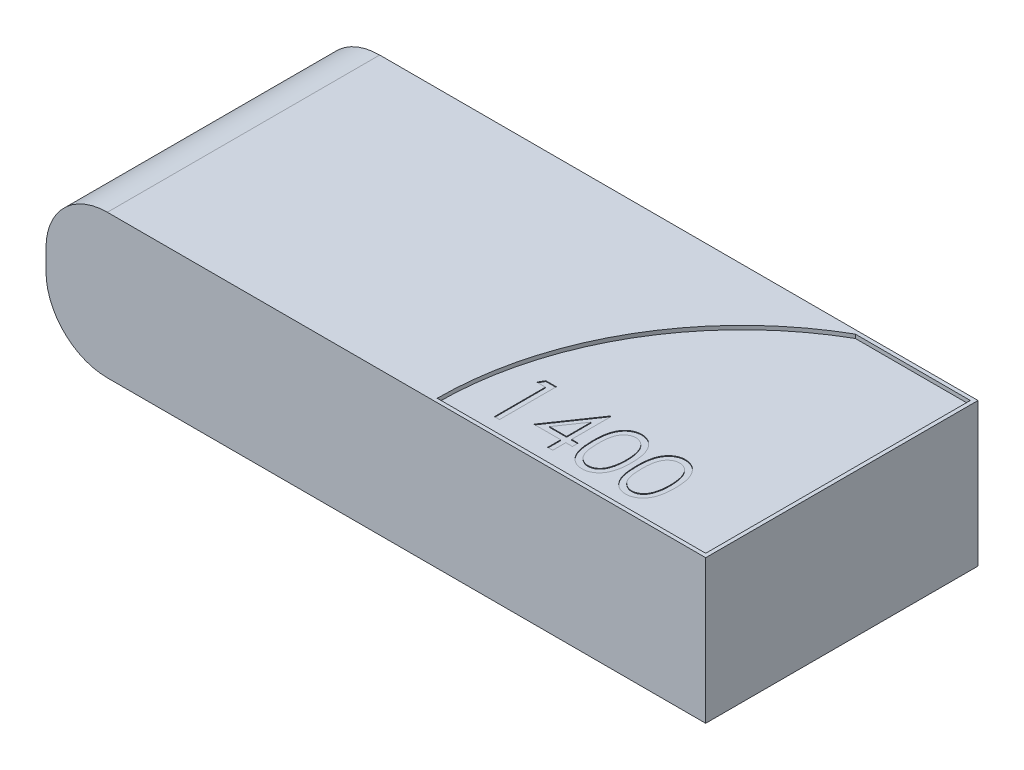
from build123d import *

# Parameters (mm, degrees)
CROQUIS1_W              = 86
CROQUIS1_H              = 35.5
SALIENTE_EXTRUIR1_DEPTH = 18.7
REDONDEO2_R             = 8
CORTAR_EXTRUIR1_DEPTH   = 0.5
CORTAR_EXTRUIR2_DEPTH   = 0.1


with BuildPart() as part:
    # Croquis1 → Saliente-Extruir1 (new body)
    with BuildSketch(Plane(origin=(0, 0, 0), x_dir=(1, 0, 0), z_dir=(0, 1, 0))):
        Rectangle(CROQUIS1_W, CROQUIS1_H)
    extrude(amount=SALIENTE_EXTRUIR1_DEPTH)

    # Redondeo2
    redondeo2_edges = [part.edges().sort_by_distance(p)[0] for p in [
        (-43, 18.7, 0),
        (-43, 0, 0),
    ]]
    fillet(redondeo2_edges, radius=REDONDEO2_R)

    # Croquis2 → Cortar-Extruir1 (cut)
    with BuildSketch(Plane(origin=(0, 18.7, 0), x_dir=(1, 0, 0), z_dir=(0, 1, 0))):
        with BuildLine():
            Line((27.5, 17.25), (42.5, 17.25))
            Line((42.5, 17.25), (42.5, -17.25))
            Line((42.5, -17.25), (7.5, -17.25))
            ThreePointArc((7.5, -17.25), (12.861527817, 2.688969382), (27.5, 17.25))
        make_face()
    extrude(amount=-CORTAR_EXTRUIR1_DEPTH, mode=Mode.SUBTRACT)

    # Croquis3 → Cortar-Extruir2 (cut)
    # profile 1 of 4: a face of its own
    with BuildSketch(Plane(origin=(0, 18.2, 0), x_dir=(1, 0, 0), z_dir=(0, 1, 0))):
        Polygon((12.095809708, -7.683191446), (13.465579673, -7.683191446), (13.465579673, -15.09152478), (12.800729246, -15.09152478), (12.800729246, -8.443020506), (11.660985656, -8.443020506), align=None)
    # profile 2 of 4: a face of its own
    with BuildSketch(Plane(origin=(0, 18.2, 0), x_dir=(1, 0, 0), z_dir=(0, 1, 0))):
        Polygon((20.263972101, -7.493234181), (20.399019844, -7.493234181), (20.399019844, -12.622080335), (21.253827537, -12.622080335), (21.253827537, -13.381909395), (20.399019844, -13.381909395), (20.399019844, -15.09152478), (19.734169417, -15.09152478), (19.734169417, -13.381909395), (16.219960015, -13.381909395), align=None)
        Polygon((19.734169417, -12.622080335), (19.734169417, -9.40467916), (17.525916212, -12.622080335), align=None, mode=Mode.SUBTRACT)
    # profile 3 of 4: a face of its own
    with BuildSketch(Plane(origin=(0, 18.2, 0), x_dir=(1, 0, 0), z_dir=(0, 1, 0))):
        with BuildLine():
            add(Edge.make_bspline(
                [(21.918677964, -11.390326195), (21.918313125, -11.159705758), (21.926227057, -10.823231018), (21.960672267, -10.389539715), (21.994801145, -10.09502077), (22.036375107, -9.821204903), (22.091862886, -9.568824699), (22.154967053, -9.336711858), (22.228102967, -9.124109523), (22.310627144, -8.928153385), (22.400446323, -8.745220042), (22.501125139, -8.575586286), (22.606909605, -8.416544629), (22.722081823, -8.270698476), (22.843364263, -8.135988168), (22.975490567, -8.015527101), (23.113969268, -7.905785681), (23.260054117, -7.809584594), (23.409581096, -7.724847557), (23.563579396, -7.652461757), (23.722469512, -7.595529094), (23.884823151, -7.54857043), (24.108615463, -7.505053349), (24.28033481, -7.492484949), (24.395542614, -7.493234181)],
                knots=[0, 0, 0, 0, 0.133246042, 0.194312586, 0.251279223, 0.304513439, 0.354234907, 0.400480589, 0.443410755, 0.484014869, 0.523252301, 0.561042373, 0.597900239, 0.633518489, 0.668314351, 0.702495671, 0.736685354, 0.770293169, 0.803437255, 0.835912952, 0.868460246, 0.900846538, 0.933466525, 1, 1, 1, 1], degree=3))
            add(Edge.make_bspline(
                [(24.395542614, -7.493234181), (24.512666822, -7.492895687), (24.686970466, -7.504648532), (24.914087617, -7.548841179), (25.078590081, -7.595192223), (25.239721551, -7.652769332), (25.396220213, -7.724916905), (25.549058554, -7.808904798), (25.695807658, -7.907591744), (25.838078595, -8.017620966), (25.972376783, -8.142001929), (26.098714448, -8.27947884), (26.218677178, -8.428580784), (26.328861525, -8.592167547), (26.433791957, -8.767393913), (26.527712764, -8.957324243), (26.618167837, -9.158789568), (26.696245251, -9.377364308), (26.766658971, -9.611816403), (26.823552104, -9.864915021), (26.870945517, -10.135332722), (26.907647533, -10.424060612), (26.944344957, -10.843884384), (26.950545458, -11.168663373), (26.952545485, -11.390326195)],
                knots=[0, 0, 0, 0, 0.067193932, 0.099862411, 0.132566612, 0.165151173, 0.197913187, 0.231319004, 0.265083278, 0.299255309, 0.334398567, 0.369942824, 0.406283561, 0.44406382, 0.482997707, 0.523354447, 0.56553659, 0.609612924, 0.656390811, 0.705885495, 0.7583245, 0.813831783, 0.872794559, 1, 1, 1, 1], degree=3))
            add(Edge.make_bspline(
                [(26.952545485, -11.390326195), (26.950329383, -11.610974536), (26.944749889, -11.934345357), (26.907118482, -12.352018265), (26.872815429, -12.639482078), (26.825292237, -12.908421114), (26.76686179, -13.159763429), (26.701985153, -13.394595072), (26.621901535, -13.610992084), (26.534248858, -13.811973232), (26.438882028, -13.999652029), (26.336710895, -14.175687349), (26.225398052, -14.338670147), (26.106751661, -14.489754969), (25.978232341, -14.626274945), (25.843462935, -14.751519504), (25.700773325, -14.862965558), (25.551735531, -14.960511332), (25.399422188, -15.047748761), (25.241130562, -15.118086017), (25.080448628, -15.178504646), (24.915075115, -15.224576231), (24.687311363, -15.267730543), (24.512898282, -15.2833612), (24.395542614, -15.281482044)],
                knots=[0, 0, 0, 0, 0.126773166, 0.185515763, 0.240764679, 0.292979796, 0.342250373, 0.388919286, 0.432775664, 0.474628433, 0.514774691, 0.553605893, 0.591426406, 0.62802812, 0.663803634, 0.698984336, 0.733591489, 0.767628469, 0.801208348, 0.83426384, 0.866980695, 0.899719742, 0.932701912, 1, 1, 1, 1], degree=3))
            add(Edge.make_bspline(
                [(24.395542614, -15.281482044), (24.280359086, -15.282136435), (24.108568403, -15.26984673), (23.885491342, -15.225994642), (23.723992842, -15.180714781), (23.56586391, -15.125212787), (23.413260141, -15.052924599), (23.264484534, -14.969666461), (23.119934076, -14.874849766), (22.982325001, -14.766218793), (22.850882954, -14.646067736), (22.728909997, -14.511398177), (22.615384494, -14.364336574), (22.507489341, -14.206235878), (22.408240166, -14.034937488), (22.316438531, -13.851120629), (22.23252645, -13.653597718), (22.158128551, -13.439486455), (22.092410464, -13.206337356), (22.040523979, -12.952092614), (21.99610259, -12.678794098), (21.960310019, -12.385267978), (21.926531926, -11.953938062), (21.918188685, -11.619475384), (21.918677964, -11.390326195)],
                knots=[0, 0, 0, 0, 0.066621658, 0.099284878, 0.131361165, 0.163585188, 0.196103927, 0.228902254, 0.262158056, 0.295991222, 0.330217846, 0.365059826, 0.400950737, 0.437620382, 0.475707529, 0.515380692, 0.556413541, 0.59976483, 0.646424156, 0.696431445, 0.749781518, 0.806573307, 0.867435532, 1, 1, 1, 1], degree=3))
        make_face()
        with BuildLine():
            add(Edge.make_bspline(
                [(22.583528391, -11.387358113), (22.58175995, -11.579410299), (22.590285803, -11.85870666), (22.614583447, -12.217710128), (22.63707085, -12.459546892), (22.670529213, -12.682114392), (22.708006483, -12.886943561), (22.7536171, -13.072950378), (22.807581438, -13.241411245), (22.869047555, -13.395185104), (22.936158293, -13.538274351), (23.008253492, -13.672369254), (23.088939025, -13.796265497), (23.176812581, -13.910366496), (23.269889295, -14.016694039), (23.371642994, -14.11150928), (23.512408951, -14.225255502), (23.698246977, -14.342594759), (24.007198977, -14.478529613), (24.25439921, -14.52169518), (24.417803231, -14.521652985)],
                knots=[0, 0, 0, 0, 0.141583694, 0.20592646, 0.265301357, 0.320597233, 0.371816503, 0.41878977, 0.461698729, 0.502133582, 0.540804315, 0.578180525, 0.614296865, 0.649678243, 0.68429946, 0.718358953, 0.752080865, 0.817652439, 0.879722076, 1, 1, 1, 1], degree=3))
            add(Edge.make_bspline(
                [(24.417803231, -14.521652985), (24.582085929, -14.524335037), (24.827635555, -14.479158561), (25.135678733, -14.347789878), (25.317872242, -14.231680096), (25.456475735, -14.120891284), (25.555784019, -14.026462674), (25.646930279, -13.920720672), (25.733385854, -13.806636303), (25.812648944, -13.682014815), (25.910940828, -13.498897795), (25.971116925, -13.351378999), (26.007211284, -13.249829734)],
                knots=[0, 0, 0, 0, 0.225393884, 0.339594815, 0.45967541, 0.52173519, 0.583925839, 0.648174145, 0.713881038, 0.781004455, 0.851450928, 1, 1, 1, 1], degree=3))
            add(Edge.make_bspline(
                [(26.007211284, -13.249829734), (26.053512838, -13.116052813), (26.119039252, -12.909639955), (26.179348223, -12.622852358), (26.220786577, -12.395479538), (26.249018757, -12.157479973), (26.280046558, -11.820913021), (26.287416134, -11.562564694), (26.287695058, -11.387358113)],
                knots=[0, 0, 0, 0, 0.224541754, 0.342503494, 0.464324098, 0.590756033, 0.722227475, 1, 1, 1, 1], degree=3))
            add(Edge.make_bspline(
                [(26.287695058, -11.387358113), (26.284764144, -11.213301687), (26.283722249, -10.957735766), (26.253067023, -10.626739137), (26.228080747, -10.396214268), (26.191259489, -10.178725555), (26.151554756, -9.972455884), (26.098212367, -9.779959779), (26.041232132, -9.598223673), (25.976016806, -9.429312287), (25.904228499, -9.272438099), (25.827559112, -9.126843791), (25.744284696, -8.992928673), (25.655393858, -8.870093449), (25.558540292, -8.760799071), (25.457566345, -8.661664908), (25.316135174, -8.548483155), (25.130991713, -8.433238256), (24.826802264, -8.292356854), (24.579395495, -8.255206017), (24.417803231, -8.253063241)],
                knots=[0, 0, 0, 0, 0.128486464, 0.18817513, 0.245106131, 0.299448425, 0.350822936, 0.399941681, 0.446671744, 0.491254533, 0.533376344, 0.573852755, 0.612526312, 0.649597136, 0.685532042, 0.720105786, 0.753837663, 0.818925416, 0.880493462, 1, 1, 1, 1], degree=3))
            add(Edge.make_bspline(
                [(24.417803231, -8.253063241), (24.254273619, -8.255316681), (24.004453591, -8.292023195), (23.697376776, -8.432683931), (23.512722895, -8.54886595), (23.371193108, -8.659667204), (23.271535038, -8.755731373), (23.178092225, -8.860817), (23.092012282, -8.975967429), (23.01138996, -9.099719204), (22.937346817, -9.2330454), (22.870635143, -9.376621794), (22.809072844, -9.53032658), (22.754943901, -9.698772915), (22.710294481, -9.88455061), (22.669049138, -10.088728313), (22.639839614, -10.312501136), (22.613921085, -10.554398929), (22.590665876, -10.914584274), (22.581537177, -11.194284816), (22.583528391, -11.387358113)],
                knots=[0, 0, 0, 0, 0.120883249, 0.182754619, 0.24781103, 0.2812991, 0.315087624, 0.349702396, 0.384856581, 0.420966197, 0.458511188, 0.497174722, 0.537602048, 0.580503018, 0.62746754, 0.67838821, 0.733983221, 0.793746705, 0.857713672, 1, 1, 1, 1], degree=3))
        make_face(mode=Mode.SUBTRACT)
    # profile 4 of 4: a face of its own
    with BuildSketch(Plane(origin=(0, 18.2, 0), x_dir=(1, 0, 0), z_dir=(0, 1, 0))):
        with BuildLine():
            add(Edge.make_bspline(
                [(27.617395913, -11.390326195), (27.617031074, -11.159705758), (27.624945006, -10.823231018), (27.659390215, -10.389539715), (27.693519094, -10.09502077), (27.735093056, -9.821204903), (27.790580835, -9.568824699), (27.853685001, -9.336711858), (27.926820915, -9.124109523), (28.009345092, -8.928153385), (28.099164272, -8.745220042), (28.199843088, -8.575586286), (28.305627553, -8.416544629), (28.420799772, -8.270698476), (28.542082211, -8.135988168), (28.674208516, -8.015527101), (28.812687217, -7.905785681), (28.958772066, -7.809584594), (29.108299045, -7.724847557), (29.262297345, -7.652461757), (29.421187461, -7.595529094), (29.583541099, -7.54857043), (29.807333412, -7.505053349), (29.979052759, -7.492484949), (30.094260563, -7.493234181)],
                knots=[0, 0, 0, 0, 0.133246042, 0.194312586, 0.251279223, 0.304513439, 0.354234907, 0.400480589, 0.443410755, 0.484014869, 0.523252301, 0.561042373, 0.597900239, 0.633518489, 0.668314351, 0.702495671, 0.736685354, 0.770293169, 0.803437255, 0.835912952, 0.868460246, 0.900846538, 0.933466525, 1, 1, 1, 1], degree=3))
            add(Edge.make_bspline(
                [(30.094260563, -7.493234181), (30.21138477, -7.492895687), (30.385688415, -7.504648532), (30.612805566, -7.548841179), (30.777308029, -7.595192223), (30.938439499, -7.652769332), (31.094938162, -7.724916905), (31.247776503, -7.808904798), (31.394525606, -7.907591744), (31.536796544, -8.017620966), (31.671094732, -8.142001929), (31.797432397, -8.27947884), (31.917395127, -8.428580784), (32.027579474, -8.592167547), (32.132509906, -8.767393913), (32.226430713, -8.957324243), (32.316885785, -9.158789568), (32.394963199, -9.377364308), (32.46537692, -9.611816403), (32.522270052, -9.864915021), (32.569663465, -10.135332722), (32.606365481, -10.424060612), (32.643062905, -10.843884384), (32.649263407, -11.168663373), (32.651263434, -11.390326195)],
                knots=[0, 0, 0, 0, 0.067193932, 0.099862411, 0.132566612, 0.165151173, 0.197913187, 0.231319004, 0.265083278, 0.299255309, 0.334398567, 0.369942824, 0.406283561, 0.44406382, 0.482997707, 0.523354447, 0.56553659, 0.609612924, 0.656390811, 0.705885495, 0.7583245, 0.813831783, 0.872794559, 1, 1, 1, 1], degree=3))
            add(Edge.make_bspline(
                [(32.651263434, -11.390326195), (32.649047331, -11.610974536), (32.643467838, -11.934345357), (32.605836431, -12.352018265), (32.571533377, -12.639482078), (32.524010186, -12.908421114), (32.465579739, -13.159763429), (32.400703102, -13.394595072), (32.320619484, -13.610992084), (32.232966807, -13.811973232), (32.137599977, -13.999652029), (32.035428844, -14.175687349), (31.924116001, -14.338670147), (31.805469609, -14.489754969), (31.67695029, -14.626274945), (31.542180884, -14.751519504), (31.399491273, -14.862965558), (31.25045348, -14.960511332), (31.098140136, -15.047748761), (30.939848511, -15.118086017), (30.779166577, -15.178504646), (30.613793064, -15.224576231), (30.386029312, -15.267730543), (30.211616231, -15.2833612), (30.094260563, -15.281482044)],
                knots=[0, 0, 0, 0, 0.126773166, 0.185515763, 0.240764679, 0.292979796, 0.342250373, 0.388919286, 0.432775664, 0.474628433, 0.514774691, 0.553605893, 0.591426406, 0.62802812, 0.663803634, 0.698984336, 0.733591489, 0.767628469, 0.801208348, 0.83426384, 0.866980695, 0.899719742, 0.932701912, 1, 1, 1, 1], degree=3))
            add(Edge.make_bspline(
                [(30.094260563, -15.281482044), (29.979077035, -15.282136435), (29.807286351, -15.26984673), (29.584209291, -15.225994642), (29.42271079, -15.180714781), (29.264581858, -15.125212787), (29.11197809, -15.052924599), (28.963202483, -14.969666461), (28.818652025, -14.874849766), (28.68104295, -14.766218793), (28.549600902, -14.646067736), (28.427627945, -14.511398177), (28.314102443, -14.364336574), (28.20620729, -14.206235878), (28.106958115, -14.034937488), (28.01515648, -13.851120629), (27.931244399, -13.653597718), (27.8568465, -13.439486455), (27.791128413, -13.206337356), (27.739241928, -12.952092614), (27.694820539, -12.678794098), (27.659027968, -12.385267978), (27.625249875, -11.953938062), (27.616906634, -11.619475384), (27.617395913, -11.390326195)],
                knots=[0, 0, 0, 0, 0.066621658, 0.099284878, 0.131361165, 0.163585188, 0.196103927, 0.228902254, 0.262158056, 0.295991222, 0.330217846, 0.365059826, 0.400950737, 0.437620382, 0.475707529, 0.515380692, 0.556413541, 0.59976483, 0.646424156, 0.696431445, 0.749781518, 0.806573307, 0.867435532, 1, 1, 1, 1], degree=3))
        make_face()
        with BuildLine():
            add(Edge.make_bspline(
                [(28.28224634, -11.387358113), (28.280477899, -11.579410299), (28.289003752, -11.85870666), (28.313301396, -12.217710128), (28.335788798, -12.459546892), (28.369247162, -12.682114392), (28.406724431, -12.886943561), (28.452335049, -13.072950378), (28.506299387, -13.241411245), (28.567765504, -13.395185104), (28.634876241, -13.538274351), (28.70697144, -13.672369254), (28.787656974, -13.796265497), (28.875530529, -13.910366496), (28.968607244, -14.016694039), (29.070360942, -14.11150928), (29.211126899, -14.225255502), (29.396964926, -14.342594759), (29.705916926, -14.478529613), (29.953117158, -14.52169518), (30.11652118, -14.521652985)],
                knots=[0, 0, 0, 0, 0.141583694, 0.20592646, 0.265301357, 0.320597233, 0.371816503, 0.41878977, 0.461698729, 0.502133582, 0.540804315, 0.578180525, 0.614296865, 0.649678243, 0.68429946, 0.718358953, 0.752080865, 0.817652439, 0.879722076, 1, 1, 1, 1], degree=3))
            add(Edge.make_bspline(
                [(30.11652118, -14.521652985), (30.280803878, -14.524335037), (30.526353503, -14.479158561), (30.834396682, -14.347789878), (31.016590191, -14.231680096), (31.155193684, -14.120891284), (31.254501967, -14.026462674), (31.345648228, -13.920720672), (31.432103802, -13.806636303), (31.511366893, -13.682014815), (31.609658776, -13.498897795), (31.669834874, -13.351378999), (31.705929233, -13.249829734)],
                knots=[0, 0, 0, 0, 0.225393884, 0.339594815, 0.45967541, 0.52173519, 0.583925839, 0.648174145, 0.713881038, 0.781004455, 0.851450928, 1, 1, 1, 1], degree=3))
            add(Edge.make_bspline(
                [(31.705929233, -13.249829734), (31.752230787, -13.116052813), (31.817757201, -12.909639955), (31.878066172, -12.622852358), (31.919504525, -12.395479538), (31.947736706, -12.157479973), (31.978764507, -11.820913021), (31.986134083, -11.562564694), (31.986413007, -11.387358113)],
                knots=[0, 0, 0, 0, 0.224541754, 0.342503494, 0.464324098, 0.590756033, 0.722227475, 1, 1, 1, 1], degree=3))
            add(Edge.make_bspline(
                [(31.986413007, -11.387358113), (31.983482092, -11.213301687), (31.982440197, -10.957735766), (31.951784971, -10.626739137), (31.926798695, -10.396214268), (31.889977438, -10.178725555), (31.850272705, -9.972455884), (31.796930315, -9.779959779), (31.739950081, -9.598223673), (31.674734755, -9.429312287), (31.602946448, -9.272438099), (31.526277061, -9.126843791), (31.443002645, -8.992928673), (31.354111807, -8.870093449), (31.25725824, -8.760799071), (31.156284294, -8.661664908), (31.014853123, -8.548483155), (30.829709662, -8.433238256), (30.525520213, -8.292356854), (30.278113444, -8.255206017), (30.11652118, -8.253063241)],
                knots=[0, 0, 0, 0, 0.128486464, 0.18817513, 0.245106131, 0.299448425, 0.350822936, 0.399941681, 0.446671744, 0.491254533, 0.533376344, 0.573852755, 0.612526312, 0.649597136, 0.685532042, 0.720105786, 0.753837663, 0.818925416, 0.880493462, 1, 1, 1, 1], degree=3))
            add(Edge.make_bspline(
                [(30.11652118, -8.253063241), (29.952991568, -8.255316681), (29.70317154, -8.292023195), (29.396094725, -8.432683931), (29.211440844, -8.54886595), (29.069911057, -8.659667204), (28.970252987, -8.755731373), (28.876810173, -8.860817), (28.790730231, -8.975967429), (28.710107909, -9.099719204), (28.636064765, -9.2330454), (28.569353091, -9.376621794), (28.507790793, -9.53032658), (28.45366185, -9.698772915), (28.409012429, -9.88455061), (28.367767087, -10.088728313), (28.338557563, -10.312501136), (28.312639033, -10.554398929), (28.289383825, -10.914584274), (28.280255126, -11.194284816), (28.28224634, -11.387358113)],
                knots=[0, 0, 0, 0, 0.120883249, 0.182754619, 0.24781103, 0.2812991, 0.315087624, 0.349702396, 0.384856581, 0.420966197, 0.458511188, 0.497174722, 0.537602048, 0.580503018, 0.62746754, 0.67838821, 0.733983221, 0.793746705, 0.857713672, 1, 1, 1, 1], degree=3))
        make_face(mode=Mode.SUBTRACT)
    extrude(amount=-CORTAR_EXTRUIR2_DEPTH, mode=Mode.SUBTRACT)


solid = part.part
